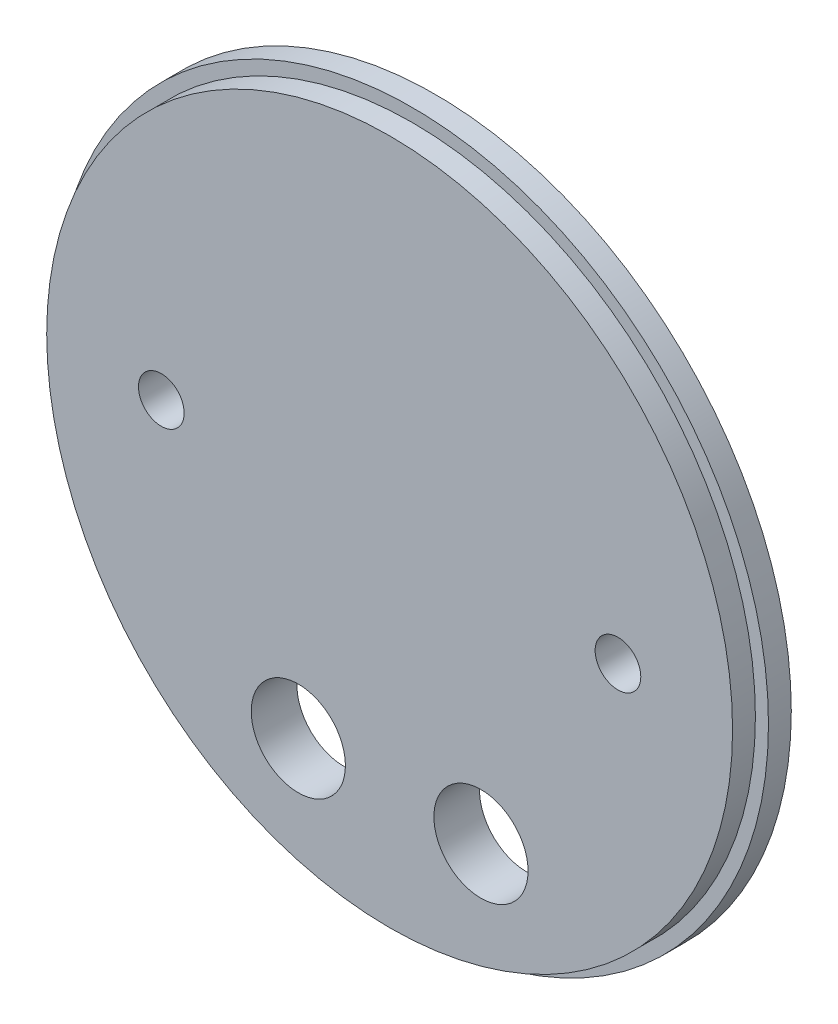
from build123d import *

# Parameters (mm, degrees)
SKETCH1_R           = 49.5046
BOSS_EXTRUDE1_DEPTH = 3.175
SKETCH2_R           = 47.6885
BOSS_EXTRUDE2_DEPTH = 3.175
SKETCH3_R           = 6.5484375
SKETCH3_R_2         = 3.175
CUT_EXTRUDE1_DEPTH  = 71.297463271


with BuildPart() as part:
    # Sketch1 → Boss-Extrude1 (new body)
    with BuildSketch(Plane.XY):
        Circle(SKETCH1_R)
    extrude(amount=BOSS_EXTRUDE1_DEPTH)

    # Sketch2 → Boss-Extrude2 (add)
    with BuildSketch(Plane.XY.offset(3.175)):
        Circle(SKETCH2_R)
    extrude(amount=BOSS_EXTRUDE2_DEPTH)

    # Sketch3 → Cut-Extrude1 (cut, through all)
    with BuildSketch(Plane.XY.offset(6.35)):
        with Locations((-12.7, -31.235352443)):
            Circle(SKETCH3_R)
        with Locations((12.7, -31.235352443)):
            Circle(SKETCH3_R)
        with Locations((-31.75, 0)):
            Circle(SKETCH3_R_2)
        with Locations((31.75, 0)):
            Circle(SKETCH3_R_2)
    extrude(amount=-CUT_EXTRUDE1_DEPTH, mode=Mode.SUBTRACT)


solid = part.part
